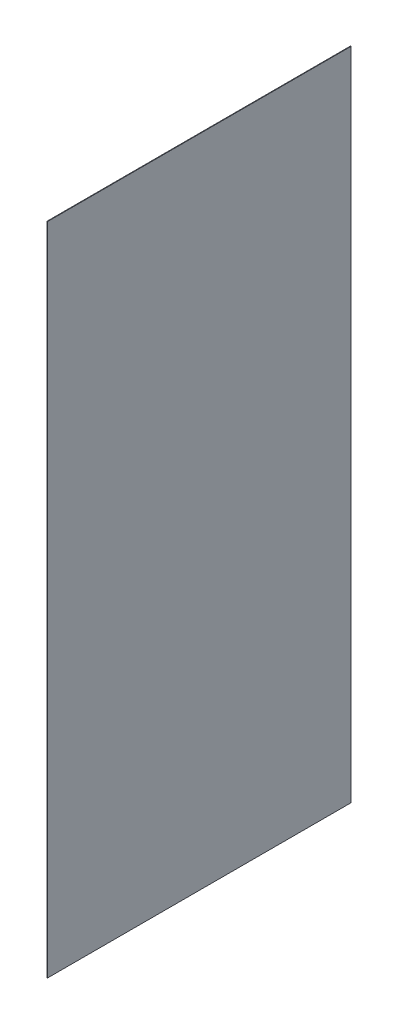
from build123d import *

# Parameters (mm, degrees)
SKETCH1_W                   = 1.5
SKETCH1_H                   = 1770
TOPPING_DIS_YAN_SOL_1_DEPTH = 820


with BuildPart() as part:
    # Sketch1 → TOPPING_dis_yan_sol_1 (new body)
    with BuildSketch(Plane.XY):
        with Locations((0.75, 1085)):
            Rectangle(SKETCH1_W, SKETCH1_H)
    extrude(amount=-TOPPING_DIS_YAN_SOL_1_DEPTH)


solid = part.part
